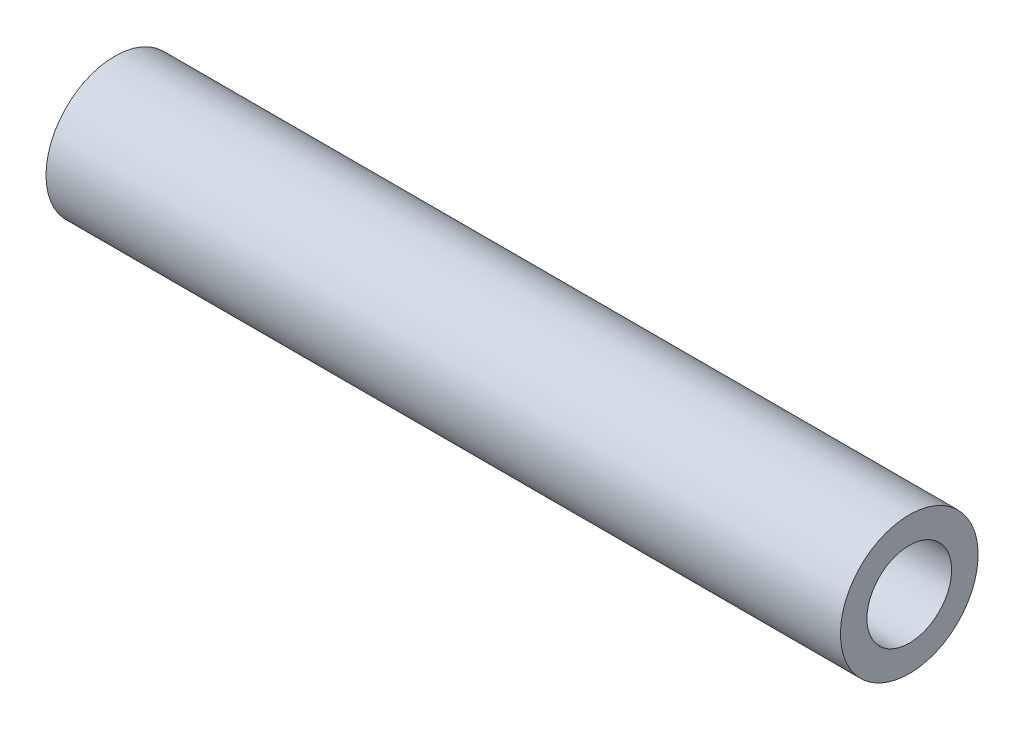
from build123d import *

# Parameters (mm, degrees)
SKETCH1_W = 150
SKETCH1_H = 5


with BuildPart() as part:
    # Sketch1 → Revolve1 (revolve)
    with BuildSketch(Plane.XY, mode=Mode.PRIVATE) as revolve1_sk:
        with Locations((0, 10.5)):
            Rectangle(SKETCH1_W, SKETCH1_H)
    revolve(revolve1_sk.sketch.rotate(Axis((-101.395540413, 0, 0), (1, 0, 0)), 90), axis=Axis((-101.395540413, 0, 0), (1, 0, 0)))


solid = part.part
